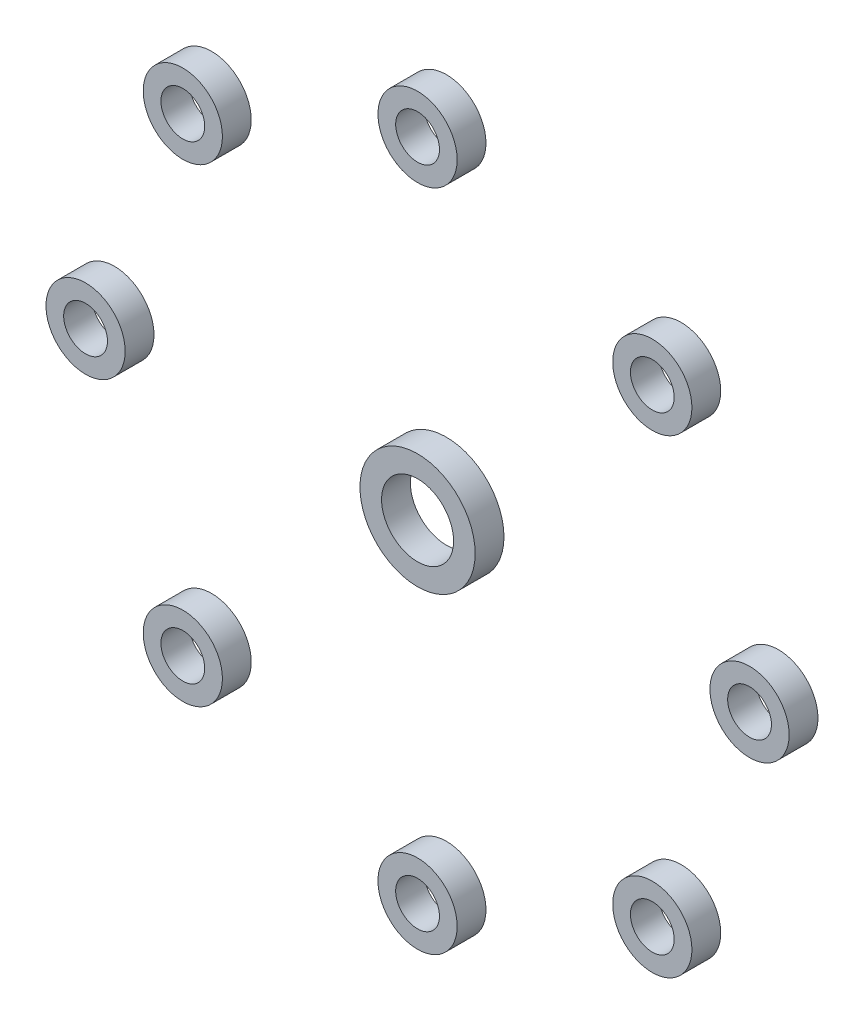
from build123d import *

# Parameters (mm, degrees)
EXTRUDE_START     = 0.899582
SKETCH_1_R        = 2.75
SKETCH_1_R_2      = 1.52
EXTRUDE_1_DEPTH   = 2
EXTRUDE_1_2_DEPTH = 2
EXTRUDE_1_3_DEPTH = 2
EXTRUDE_1_4_DEPTH = 2
EXTRUDE_1_5_DEPTH = 2
EXTRUDE_1_6_DEPTH = 2
EXTRUDE_1_7_DEPTH = 2
EXTRUDE_1_8_DEPTH = 2
SKETCH_1_R_3      = 4
SKETCH_1_R_4      = 2.5
EXTRUDE_1_9_DEPTH = 2


with BuildPart() as part:
    # 草图1 → 凸台-拉伸1 (new body)
    with BuildSketch(Plane.XY.offset(EXTRUDE_START)):
        with Locations((-22.803986485, 32.400306763)):
            Circle(SKETCH_1_R)
        with Locations((-22.803986485, 32.400306763)):
            Circle(SKETCH_1_R_2, mode=Mode.SUBTRACT)
    extrude(amount=-EXTRUDE_1_DEPTH)


with BuildPart() as body_2:
    # 草图1 → Extrude 1 2 (new body)
    with BuildSketch(Plane.XY.offset(EXTRUDE_START)):
        with Locations((-6.505175448, 25.649118181)):
            Circle(SKETCH_1_R)
        with Locations((-6.505175448, 25.649118181)):
            Circle(SKETCH_1_R_2, mode=Mode.SUBTRACT)
    extrude(amount=-EXTRUDE_1_2_DEPTH)


with BuildPart() as body_3:
    # 草图1 → Extrude 1 3 (new body)
    with BuildSketch(Plane.XY.offset(EXTRUDE_START)):
        with Locations((0.246013135, 9.350307143)):
            Circle(SKETCH_1_R)
        with Locations((0.246013135, 9.350307143)):
            Circle(SKETCH_1_R_2, mode=Mode.SUBTRACT)
    extrude(amount=-EXTRUDE_1_3_DEPTH)


with BuildPart() as body_4:
    # 草图1 → Extrude 1 4 (new body)
    with BuildSketch(Plane.XY.offset(EXTRUDE_START)):
        with Locations((-6.505175448, -6.948503895)):
            Circle(SKETCH_1_R)
        with Locations((-6.505175448, -6.948503895)):
            Circle(SKETCH_1_R_2, mode=Mode.SUBTRACT)
    extrude(amount=-EXTRUDE_1_4_DEPTH)


with BuildPart() as body_5:
    # 草图1 → Extrude 1 5 (new body)
    with BuildSketch(Plane.XY.offset(EXTRUDE_START)):
        with Locations((-22.803986485, -13.699692477)):
            Circle(SKETCH_1_R)
        with Locations((-22.803986485, -13.699692477)):
            Circle(SKETCH_1_R_2, mode=Mode.SUBTRACT)
    extrude(amount=-EXTRUDE_1_5_DEPTH)


with BuildPart() as body_6:
    # 草图1 → Extrude 1 6 (new body)
    with BuildSketch(Plane.XY.offset(EXTRUDE_START)):
        with Locations((-39.102797523, -6.948503895)):
            Circle(SKETCH_1_R)
        with Locations((-39.102797523, -6.948503895)):
            Circle(SKETCH_1_R_2, mode=Mode.SUBTRACT)
    extrude(amount=-EXTRUDE_1_6_DEPTH)


with BuildPart() as body_7:
    # 草图1 → Extrude 1 7 (new body)
    with BuildSketch(Plane.XY.offset(EXTRUDE_START)):
        with Locations((-45.853986105, 9.350307143)):
            Circle(SKETCH_1_R)
        with Locations((-45.853986105, 9.350307143)):
            Circle(SKETCH_1_R_2, mode=Mode.SUBTRACT)
    extrude(amount=-EXTRUDE_1_7_DEPTH)


with BuildPart() as body_8:
    # 草图1 → Extrude 1 8 (new body)
    with BuildSketch(Plane.XY.offset(EXTRUDE_START)):
        with Locations((-39.102797523, 25.649118181)):
            Circle(SKETCH_1_R)
        with Locations((-39.102797523, 25.649118181)):
            Circle(SKETCH_1_R_2, mode=Mode.SUBTRACT)
    extrude(amount=-EXTRUDE_1_8_DEPTH)


with BuildPart() as body_9:
    # 草图1 → Extrude 1 9 (new body)
    with BuildSketch(Plane.XY.offset(EXTRUDE_START)):
        with Locations((-22.803986485, 9.350307143)):
            Circle(SKETCH_1_R_3)
        with Locations((-22.803986485, 9.350307143)):
            Circle(SKETCH_1_R_4, mode=Mode.SUBTRACT)
    extrude(amount=-EXTRUDE_1_9_DEPTH)


solid = Compound([part.part, body_2.part, body_3.part, body_4.part, body_5.part, body_6.part, body_7.part, body_8.part, body_9.part])
